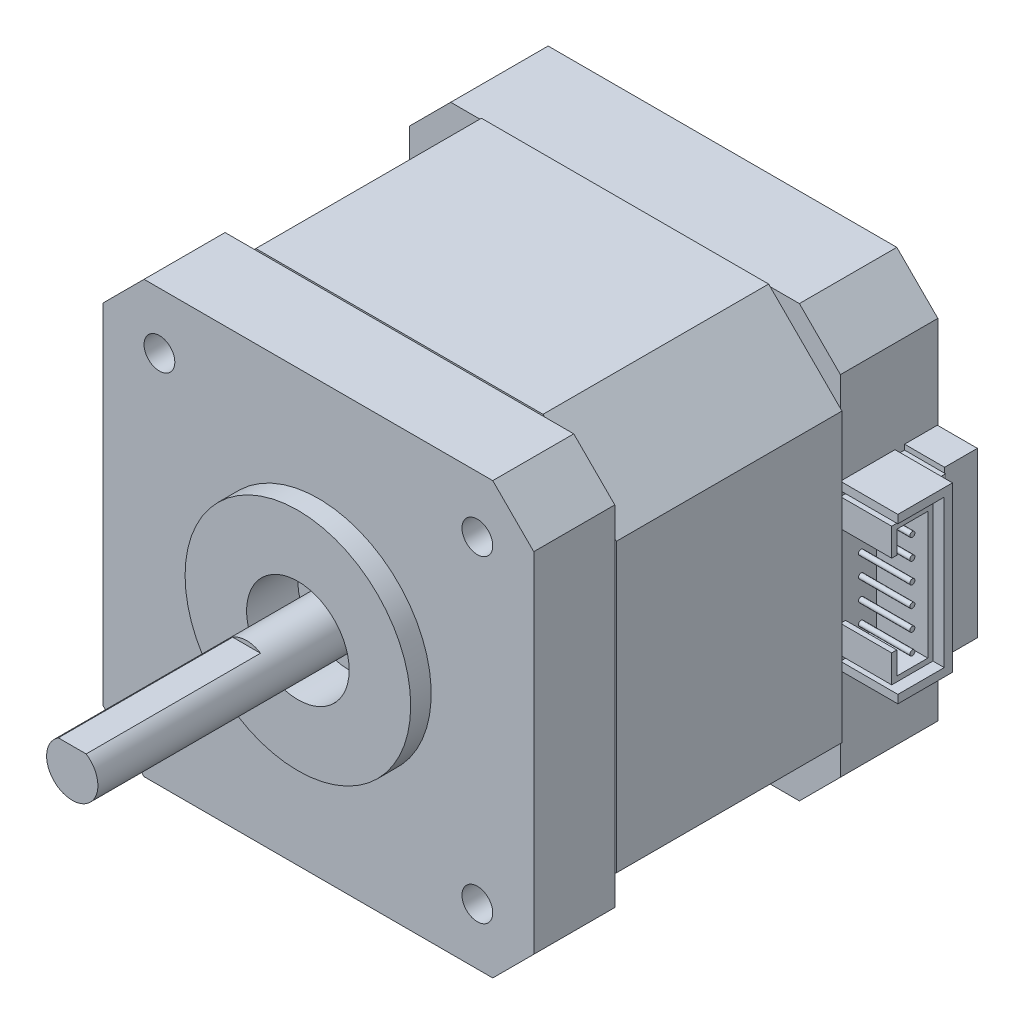
from build123d import *

# Parameters (mm, degrees)
BOSS_EXTRUDE1_DEPTH  = 9.5
BOSS_EXTRUDE2_DEPTH  = 22
BOSS_EXTRUDE3_DEPTH  = 7.9
SKETCH5_R            = 11
SKETCH5_R_2          = 5
BOSS_EXTRUDE4_DEPTH  = 2
CUT_EXTRUDE1_START   = -3
SKETCH6_R            = 5
CUT_EXTRUDE1_DEPTH   = 3
SKETCH7_R            = 2.5
BOSS_EXTRUDE5_DEPTH  = 5
SKETCH8_R            = 2.5
BOSS_EXTRUDE6_DEPTH  = 22
CUT_EXTRUDE2_DEPTH   = 17
SKETCH11_W           = 3.2
SKETCH11_H           = 16
BOSS_EXTRUDE8_DEPTH  = 3.9
BOSS_EXTRUDE9_DEPTH  = 5.6
SKETCH13_W           = 0.930512921
SKETCH13_H           = 15
BOSS_EXTRUDE10_DEPTH = 3.9
SKETCH14_W           = 0.930512921
SKETCH14_H           = 15
BOSS_EXTRUDE11_DEPTH = 0.1
BOSS_EXTRUDE12_DEPTH = 5
SKETCH16_R           = 0.25
BOSS_EXTRUDE13_DEPTH = 5
SKETCH17_R           = 1.5
CUT_EXTRUDE3_DEPTH   = 5.5
SKETCH18_R           = 3.25
CUT_EXTRUDE4_DEPTH   = 3
CUT_EXTRUDE5_START   = -4
SKETCH20_R           = 1.5
CUT_EXTRUDE5_DEPTH   = 4
SKETCH21_R           = 4.5
CUT_EXTRUDE6_DEPTH   = 4


with BuildPart() as part:
    # Sketch1 → Boss-Extrude1 (new body)
    with BuildSketch(Plane.XY):
        Polygon((-17, 21), (-21, 17), (-21, -17), (-17, -21), (17, -21), (21, -17), (21, 17), (17, 21), align=None)
    extrude(amount=BOSS_EXTRUDE1_DEPTH)

    # Sketch2 → Boss-Extrude2 (add)
    with BuildSketch(Plane.XY.offset(9.5)):
        Polygon((14, 21.15), (21.15, 14), (21.15, -14), (14, -21.15), (-14, -21.15), (-21.15, -14), (-21.15, 14), (-14, 21.15), align=None)
    extrude(amount=BOSS_EXTRUDE2_DEPTH)

    # Sketch3 → Boss-Extrude3 (add)
    with BuildSketch(Plane.XY.offset(31.5)):
        Polygon((-17, 21), (17, 21), (21, 17), (21, -17), (17, -21), (-17, -21), (-21, -17), (-21, 17), align=None)
    extrude(amount=BOSS_EXTRUDE3_DEPTH)

    # Sketch5 → Boss-Extrude4 (add)
    with BuildSketch(Plane.XY.offset(39.4)):
        with Locations(Location((0, 0, 0), (0, 0, 180))):
            Circle(SKETCH5_R)
        Circle(SKETCH5_R_2, mode=Mode.SUBTRACT)
    extrude(amount=BOSS_EXTRUDE4_DEPTH)

    # Sketch6 → Cut-Extrude1 (cut)
    with BuildSketch(Plane.XY.offset(39.4).offset(CUT_EXTRUDE1_START)):
        Circle(SKETCH6_R)
    extrude(amount=CUT_EXTRUDE1_DEPTH, mode=Mode.SUBTRACT)

    # Sketch7 → Boss-Extrude5 (add)
    with BuildSketch(Plane.XY.offset(36.4)):
        with Locations(Location((0, 0, 0), (0, 0, 180))):
            Circle(SKETCH7_R)
    extrude(amount=BOSS_EXTRUDE5_DEPTH)

    # Sketch8 → Boss-Extrude6 (add)
    with BuildSketch(Plane.XY.offset(41.4)):
        with Locations(Location((0, 0, 0), (0, 0, 180))):
            Circle(SKETCH8_R)
    extrude(amount=BOSS_EXTRUDE6_DEPTH)

    # Sketch9 → Cut-Extrude2 (cut)
    with BuildSketch(Plane.XY.offset(63.4)):
        Polygon((-2.316645086, 2.1), (3.697939095, 2.1), (-0.123554347, 3.991048302), align=None)
    extrude(amount=-CUT_EXTRUDE2_DEPTH, mode=Mode.SUBTRACT)

    # Sketch11 → Boss-Extrude8 (add)
    with BuildSketch(Plane(origin=(21, 0, 0), x_dir=(0, 0, -1), z_dir=(1, 0, 0))):
        with Locations((-1.645589959, 0)):
            Rectangle(SKETCH11_W, SKETCH11_H)
    extrude(amount=BOSS_EXTRUDE8_DEPTH)

    # Sketch12 → Boss-Extrude9 (add)
    with BuildSketch(Plane(origin=(21, 0, 0), x_dir=(0, 0, -1), z_dir=(1, 0, 0))):
        Polygon((-9.5, 7.2), (-4.97610288, 7.2), (-4.97610288, -7.2), (-9.5, -7.2), (-9.5, -8), (-4.17610288, -8), (-4.17610288, -7.2), (-4.17610288, 7.2), (-4.17610288, 8), (-9.5, 8), align=None)
    extrude(amount=BOSS_EXTRUDE9_DEPTH)

    # Sketch13 → Boss-Extrude10 (add)
    with BuildSketch(Plane(origin=(21, 0, 0), x_dir=(0, 0, -1), z_dir=(1, 0, 0))):
        with Locations((-3.71084642, 0)):
            Rectangle(SKETCH13_W, SKETCH13_H)
    extrude(amount=BOSS_EXTRUDE10_DEPTH)

    # Sketch14 → Boss-Extrude11 (add)
    with BuildSketch(Plane(origin=(24.9, 0, 0), x_dir=(0, 0, -1), z_dir=(1, 0, 0))):
        with Locations((-3.71084642, 0)):
            Rectangle(SKETCH14_W, SKETCH14_H)
    extrude(amount=BOSS_EXTRUDE11_DEPTH)

    # Sketch15 → Boss-Extrude12 (add)
    with BuildSketch(Plane(origin=(21, 0, 0), x_dir=(0, 0, -1), z_dir=(1, 0, 0))):
        Polygon((-5.97610288, 6.2), (-9, 6.2), (-9, 4), (-9.5, 4), (-9.5, 6.7), (-9, 6.7), (-5.47610288, 6.7), (-5.47610288, -6.7), (-9, -6.7), (-9.5, -6.7), (-9.5, -4), (-9, -4), (-9, -6.2), (-5.97610288, -6.2), align=None)
    extrude(amount=BOSS_EXTRUDE12_DEPTH)

    # Sketch16 → Boss-Extrude13 (add)
    with BuildSketch(Plane(origin=(21, 0, 0), x_dir=(0, 0, -1), z_dir=(1, 0, 0))):
        with Locations(Location((-7.48805144, 5, 0), (0, 0, 270))):
            Circle(SKETCH16_R)
        with Locations(Location((-7.48805144, 3, 0), (0, 0, 270))):
            Circle(SKETCH16_R)
        with Locations(Location((-7.48805144, 1, 0), (0, 0, 270))):
            Circle(SKETCH16_R)
        with Locations(Location((-7.48805144, -1, 0), (0, 0, 270))):
            Circle(SKETCH16_R)
        with Locations(Location((-7.48805144, -3, 0), (0, 0, 270))):
            Circle(SKETCH16_R)
        with Locations(Location((-7.48805144, -5, 0), (0, 0, 270))):
            Circle(SKETCH16_R)
    extrude(amount=BOSS_EXTRUDE13_DEPTH)

    # Sketch17 → Cut-Extrude3 (cut)
    with BuildSketch(Plane.XY.offset(39.4)):
        with Locations((-15.5, 15.5)):
            Circle(SKETCH17_R)
        with Locations((15.5, 15.5)):
            Circle(SKETCH17_R)
        with Locations((15.5, -15.5)):
            Circle(SKETCH17_R)
        with Locations((-15.5, -15.5)):
            Circle(SKETCH17_R)
    extrude(amount=-CUT_EXTRUDE3_DEPTH, mode=Mode.SUBTRACT)

    # Sketch18 → Cut-Extrude4 (cut)
    with BuildSketch(Plane(origin=(0, 0, 0), x_dir=(-1, 0, 0), z_dir=(0, 0, -1))):
        with Locations((-15.5, 15.5)):
            Circle(SKETCH18_R)
        with Locations((15.5, 15.5)):
            Circle(SKETCH18_R)
        with Locations((15.5, -15.5)):
            Circle(SKETCH18_R)
        with Locations((-15.5, -15.5)):
            Circle(SKETCH18_R)
    extrude(amount=-CUT_EXTRUDE4_DEPTH, mode=Mode.SUBTRACT)

    # Sketch20 → Cut-Extrude5 (cut)
    with BuildSketch(Plane(origin=(0, 0, 3), x_dir=(-1, 0, 0), z_dir=(0, 0, -1)).offset(CUT_EXTRUDE5_START)):
        with Locations(Location((-15.5, 15.5, 0), (0, 0, 180))):
            Circle(SKETCH20_R)
        with Locations(Location((15.5, 15.5, 0), (0, 0, 180))):
            Circle(SKETCH20_R)
        with Locations(Location((-15.5, -15.5, 0), (0, 0, 180))):
            Circle(SKETCH20_R)
        with Locations(Location((15.5, -15.5, 0), (0, 0, 180))):
            Circle(SKETCH20_R)
    extrude(amount=CUT_EXTRUDE5_DEPTH, mode=Mode.SUBTRACT)

    # Sketch21 → Cut-Extrude6 (cut)
    with BuildSketch(Plane(origin=(0, 0, 0), x_dir=(-1, 0, 0), z_dir=(0, 0, -1))):
        Circle(SKETCH21_R)
    extrude(amount=-CUT_EXTRUDE6_DEPTH, mode=Mode.SUBTRACT)


solid = part.part
